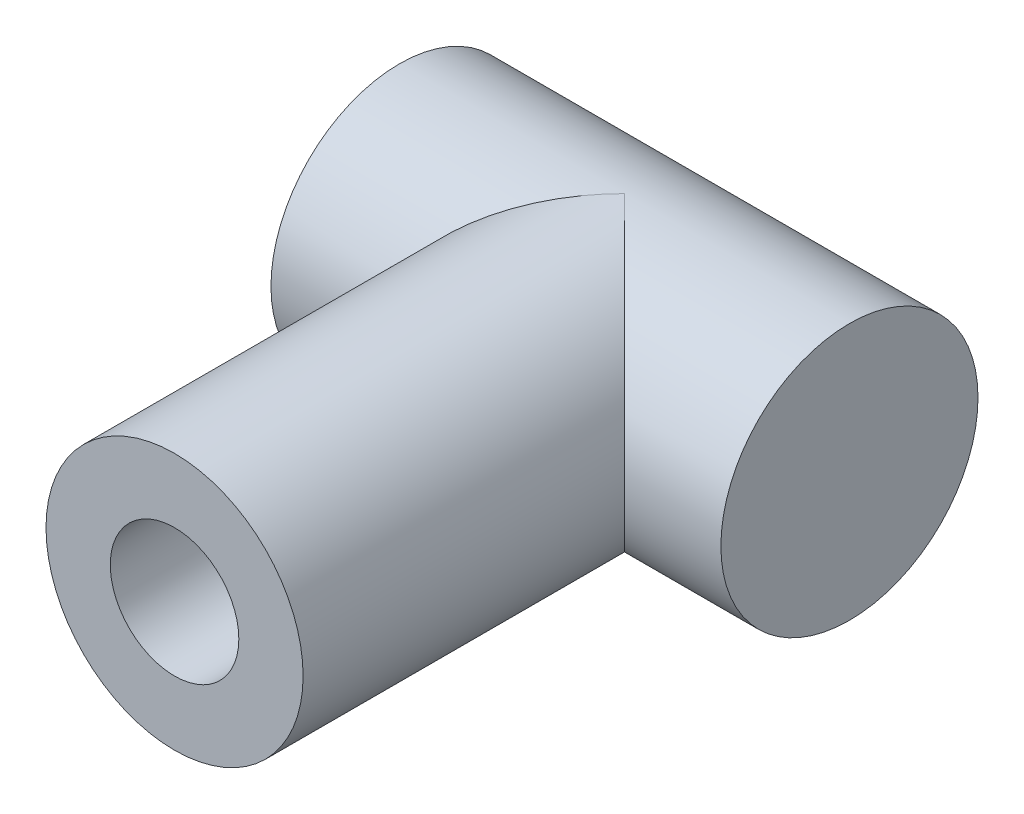
from build123d import *

# Parameters (mm, degrees)
SKETCH_22_R         = 10
EXTRUDE_12_DEPTH    = 17.5
SKETCH_25_R         = 10
EXTRUDE_13_DEPTH    = 35
SKETCH_26_R         = 5
CUT_EXTRUDE_6_DEPTH = 12


with BuildPart() as part:
    # 草图22 → 凸台-拉伸12 (new, symmetric)
    with BuildSketch(Plane(origin=(0, 0, 0), x_dir=(0, 0, -1), z_dir=(1, 0, 0))):
        Circle(SKETCH_22_R)
    extrude(amount=EXTRUDE_12_DEPTH, both=True)

    # 草图25 → 凸台-拉伸13 (add)
    with BuildSketch(Plane.XY):
        with Locations(Location((0, 0, 0), (0, 0, 90))):
            Circle(SKETCH_25_R)
    extrude(amount=EXTRUDE_13_DEPTH)

    # 草图26 → 切除-拉伸6 (cut)
    with BuildSketch(Plane.XY.offset(35)):
        Circle(SKETCH_26_R)
    extrude(amount=-CUT_EXTRUDE_6_DEPTH, mode=Mode.SUBTRACT)


solid = part.part
